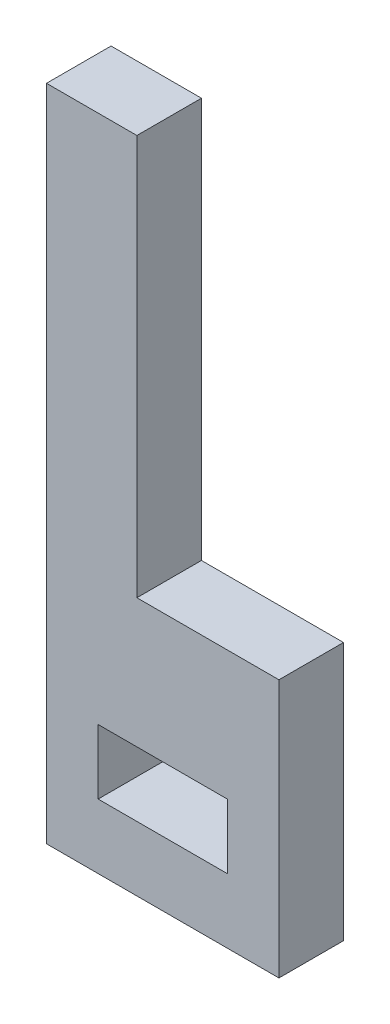
from build123d import *

# Parameters (mm, degrees)
BOSS_EXTRUDE1_DEPTH = 5
SKETCH2_W           = 10
SKETCH2_H           = 5
CUT_EXTRUDE1_DEPTH  = 55.313902456


with BuildPart() as part:
    # Sketch1 → Boss-Extrude1 (new body)
    with BuildSketch(Plane.XY):
        Polygon((0, 0), (0, 51), (7, 51), (7, 20), (18, 20), (18, 0), align=None)
    extrude(amount=BOSS_EXTRUDE1_DEPTH)

    # Sketch2 → Cut-Extrude1 (cut, through all)
    with BuildSketch(Plane.XY.offset(5)):
        with Locations((9, 7.5)):
            Rectangle(SKETCH2_W, SKETCH2_H)
    extrude(amount=-CUT_EXTRUDE1_DEPTH, mode=Mode.SUBTRACT)


solid = part.part
